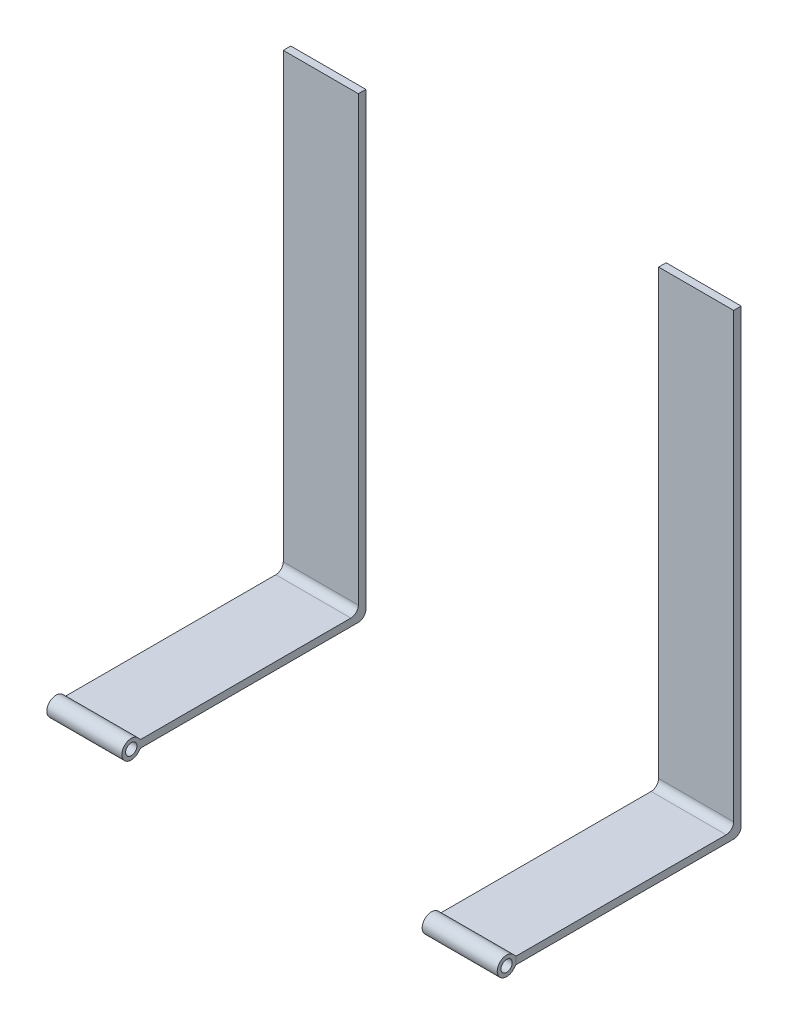
from build123d import *

# Parameters (mm, degrees)
SKETCH1_W           = 533.4
SKETCH1_H           = 203.2
SKETCH1_W_2         = 482.6
SKETCH1_H_2         = 152.4
BOSS_EXTRUDE1_DEPTH = 2.54
FILLET1_R           = 2.54
SKETCH2_W           = 25.4
SKETCH2_H           = 2.54
BOSS_EXTRUDE2_DEPTH = 76.2
SKETCH3_W           = 25.4
SKETCH3_H           = 2.54
BOSS_EXTRUDE3_DEPTH = 152.4
FILLET2_R           = 2.54
FILLET3_R           = 2.54
CUT_EXTRUDE1_DEPTH  = 355.918990757
BOSS_EXTRUDE4_START = -152.4
SKETCH5_R           = 3.175
SKETCH5_R_2         = 1.905
BOSS_EXTRUDE4_DEPTH = 152.4
SKETCH6_W           = 101.6
SKETCH6_H           = 6.35
CUT_EXTRUDE2_DEPTH  = 12.7


with BuildPart() as part:
    # Sketch1 → Boss-Extrude1 (new body)
    with BuildSketch(Plane(origin=(0, 0, 0), x_dir=(1, 0, 0), z_dir=(0, 1, 0))):
        Rectangle(SKETCH1_W, SKETCH1_H)
        Rectangle(SKETCH1_W_2, SKETCH1_H_2, mode=Mode.SUBTRACT)
    extrude(amount=BOSS_EXTRUDE1_DEPTH)

    # Fillet1
    fillet1_edges = [part.edges().sort_by_distance(p)[0] for p in [
        (-266.7, 1.27, -101.6),
        (266.7, 1.27, -101.6),
        (266.7, 1.27, 101.6),
        (-266.7, 1.27, 101.6),
    ]]
    fillet(fillet1_edges, radius=FILLET1_R)

    # Sketch2 → Boss-Extrude2 (add)
    with BuildSketch(Plane(origin=(0, 0, -101.6), x_dir=(-1, 0, 0), z_dir=(0, 0, -1))):
        with Locations((63.5, 1.27)):
            Rectangle(SKETCH2_W, SKETCH2_H)
        with Locations((-63.5, 1.27)):
            Rectangle(SKETCH2_W, SKETCH2_H)
    extrude(amount=BOSS_EXTRUDE2_DEPTH)

    # Sketch3 → Boss-Extrude3 (add)
    with BuildSketch(Plane(origin=(0, 2.54, 0), x_dir=(1, 0, 0), z_dir=(0, 1, 0))):
        with Locations((-63.5, 176.53)):
            Rectangle(SKETCH3_W, SKETCH3_H)
        with Locations((63.5, 176.53)):
            Rectangle(SKETCH3_W, SKETCH3_H)
    extrude(amount=BOSS_EXTRUDE3_DEPTH)

    # Fillet2
    fillet2_edges = [part.edges().sort_by_distance(p)[0] for p in [
        (-63.5, 2.54, -175.26),
        (63.5, 2.54, -175.26),
    ]]
    fillet(fillet2_edges, radius=FILLET2_R)

    # Fillet3
    fillet3_edges = [part.edges().sort_by_distance(p)[0] for p in [
        (-63.5, 0, -177.8),
        (63.5, 0, -177.8),
    ]]
    fillet(fillet3_edges, radius=FILLET3_R)

    # Sketch4 → Cut-Extrude1 (cut, through all)
    with BuildSketch(Plane(origin=(0, 2.54, 0), x_dir=(1, 0, 0), z_dir=(0, 1, 0))):
        with BuildLine():
            Line((-264.16, -101.6), (264.16, -101.6))
            ThreePointArc((264.16, -101.6), (265.956051224, -100.856051224), (266.7, -99.06))
            Line((266.7, -99.06), (266.7, 99.06))
            ThreePointArc((266.7, 99.06), (265.956051224, 100.856051224), (264.16, 101.6))
            Line((264.16, 101.6), (76.2, 101.6))
            Line((76.2, 101.6), (50.8, 101.6))
            Line((50.8, 101.6), (-50.8, 101.6))
            Line((-50.8, 101.6), (-76.2, 101.6))
            Line((-76.2, 101.6), (-264.16, 101.6))
            ThreePointArc((-264.16, 101.6), (-265.956051224, 100.856051224), (-266.7, 99.06))
            Line((-266.7, 99.06), (-266.7, -99.06))
            ThreePointArc((-266.7, -99.06), (-265.956051224, -100.856051224), (-264.16, -101.6))
        make_face()
    extrude(amount=-CUT_EXTRUDE1_DEPTH, mode=Mode.SUBTRACT)


with BuildPart() as cut_extrude1_piece_1:
    # of the separate pieces the step leaves, piece 1, a body of its own (cut_extrude1_pieces)
    add(part.part.solids().sort_by_distance((-76.2, 0, -175.26))[0])

    # Sketch5 → Boss-Extrude4 (add)
    # profile 1 of 3: a face of its own
    with BuildSketch(Plane.ZY.offset(76.2).offset(BOSS_EXTRUDE4_START)):
        with Locations((-98.425, 1.27)):
            Circle(SKETCH5_R)
        with Locations((-98.425, 1.27)):
            Circle(SKETCH5_R_2, mode=Mode.SUBTRACT)
    # profile 2 of 3: a face of its own
    with BuildSketch(Plane.ZY.offset(76.2).offset(BOSS_EXTRUDE4_START)):
        with BuildLine():
            ThreePointArc((-100.724137931, -0.919655172), (-101.372913494, 0.090834603), (-101.6, 1.27))
            Line((-101.6, 1.27), (-101.6, 0))
            Line((-101.6, 0), (-100.724137931, -0.919655172))
        make_face()
    # profile 3 of 3: a face of its own
    with BuildSketch(Plane.ZY.offset(76.2).offset(BOSS_EXTRUDE4_START)):
        with BuildLine():
            Line((-100.724137931, 3.459655172), (-101.6, 2.54))
            Line((-101.6, 2.54), (-101.6, 1.27))
            ThreePointArc((-101.6, 1.27), (-101.372913494, 2.449165397), (-100.724137931, 3.459655172))
        make_face()
    boss_extrude4 = extrude(amount=BOSS_EXTRUDE4_DEPTH)

    # Mirror4: Boss-Extrude4 across plane
    add(boss_extrude4.mirror(Plane(origin=(0, 0, 0), x_dir=(0, 0, 1), z_dir=(1, 0, 0))))

    # Sketch6 → Cut-Extrude2 (cut, symmetric)
    with BuildSketch(Plane(origin=(0, 2.54, 0), x_dir=(1, 0, 0), z_dir=(0, 1, 0))):
        with Locations((0, 98.425)):
            Rectangle(SKETCH6_W, SKETCH6_H)
    extrude(amount=CUT_EXTRUDE2_DEPTH, both=True, mode=Mode.SUBTRACT)


with BuildPart() as cut_extrude1_piece_2:
    # of the separate pieces the step leaves, piece 2, a body of its own (cut_extrude1_pieces)
    add(part.part.solids().sort_by_distance((76.2, 0, -175.26))[0])


with BuildPart() as cut_extrude2_piece_1:
    # of the separate pieces the step leaves, piece 1, a body of its own (cut_extrude2_pieces)
    add(cut_extrude1_piece_1.part.solids().sort_by_distance((-50.8, -0.919655172, -100.724137931))[0])


with BuildPart() as cut_extrude2_piece_2:
    # of the separate pieces the step leaves, piece 2, a body of its own (cut_extrude2_pieces)
    add(cut_extrude1_piece_1.part.solids().sort_by_distance((76.2, -0.919655172, -100.724137931))[0])


solid = Compound([cut_extrude1_piece_2.part, cut_extrude2_piece_1.part, cut_extrude2_piece_2.part])
